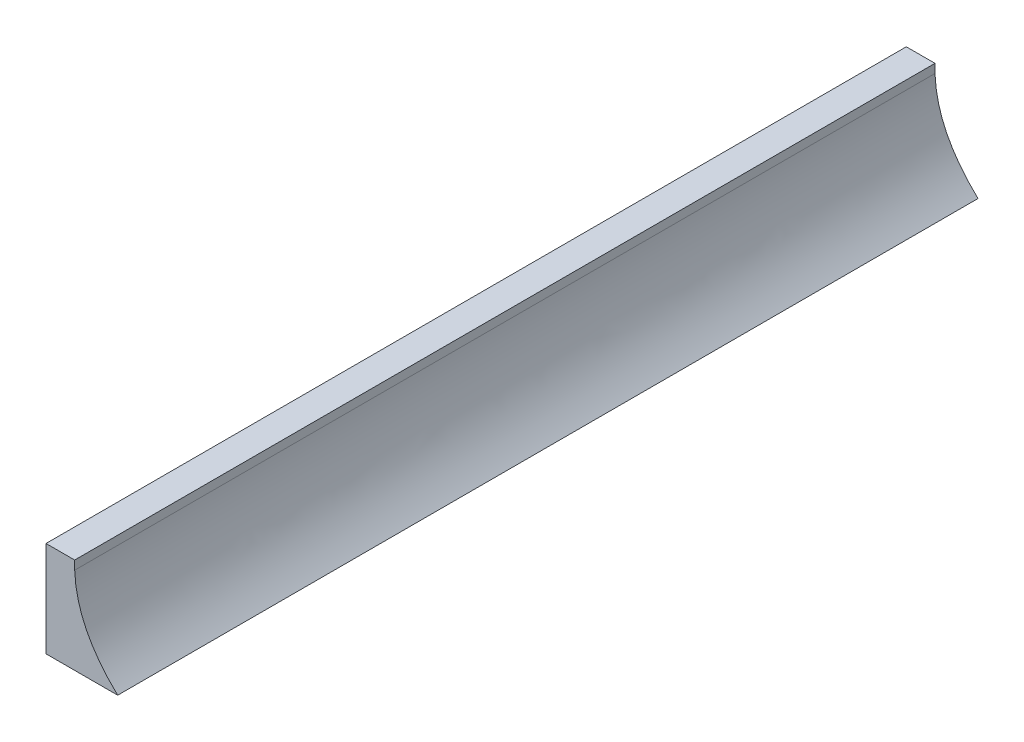
from build123d import *

# Parameters (mm, degrees)
BOSS_EXTRU_1_DEPTH      = 180
ESQUISSE2_W             = 30
ESQUISSE2_H             = 6
ENL_V_MAT_EXTRU_1_DEPTH = 6


with BuildPart() as part:
    # Esquisse1 → Boss.-Extru.1 (new body)
    with BuildSketch(Plane.XY):
        with BuildLine():
            Line((0, 0), (9, 0))
            add(Edge.make_bspline(
                [(0, 18.154922759), (0.375552148, 8.111252363), (9, 0)],
                knots=[0.083456033, 0.083456033, 0.083456033, 1, 1, 1], degree=2))
            Line((0, 18.154922759), (0, 20))
            Line((0, 20), (-6, 20))
            Line((-6, 20), (-6, 0))
            Line((-6, 0), (0, 0))
        make_face()
    extrude(amount=BOSS_EXTRU_1_DEPTH)

    # Esquisse2 → Enlèv. mat.-Extru.1 (cut)
    with BuildSketch(Plane.ZY.offset(6)):
        with Locations((55, 3)):
            Rectangle(ESQUISSE2_W, ESQUISSE2_H)
        with Locations((125, 3)):
            Rectangle(ESQUISSE2_W, ESQUISSE2_H)
    extrude(amount=-ENL_V_MAT_EXTRU_1_DEPTH, mode=Mode.SUBTRACT)


solid = part.part
